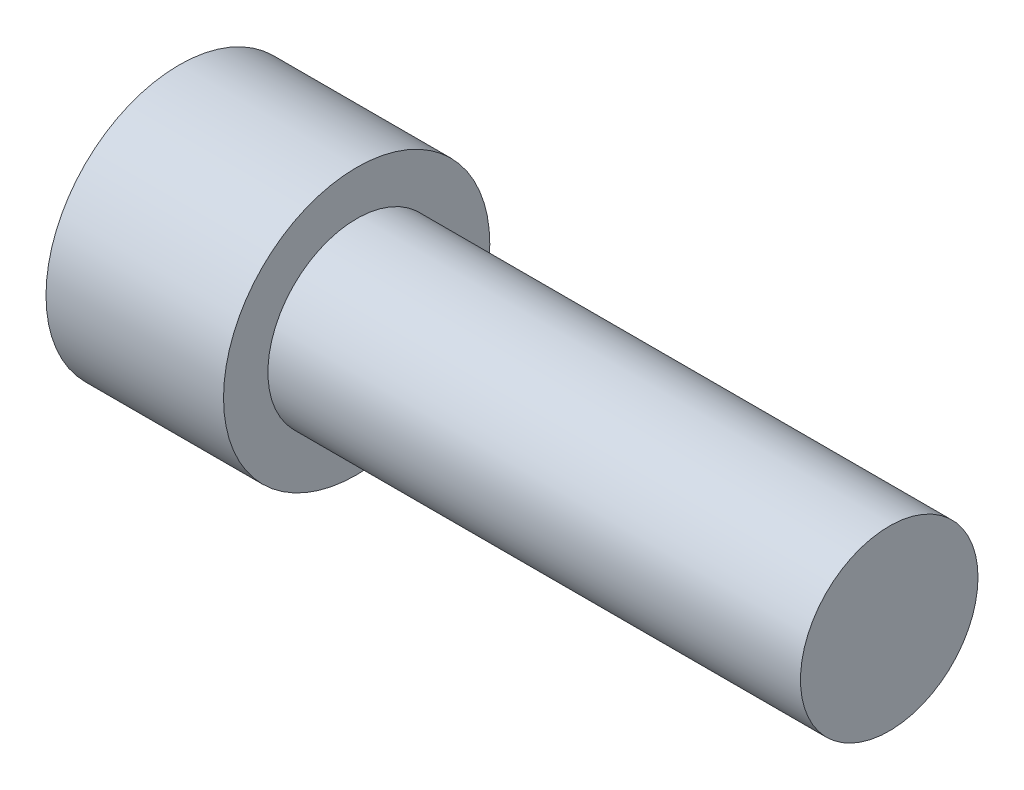
from build123d import *

# Parameters (mm, degrees)
SKETCH1_R             = 3.175
THREADED_SCREW_DEPTH  = 19.05
SKETCH2_R             = 4.7625
ROUND_HEAD_DEPTH      = 6.35
HEX_SOCKET_SIZE_DEPTH = 4


with BuildPart() as part:
    # Sketch1 → Threaded_Screw (new body)
    with BuildSketch(Plane(origin=(0, 0, 0), x_dir=(0, 0, -1), z_dir=(1, 0, 0))):
        Circle(SKETCH1_R)
    extrude(amount=THREADED_SCREW_DEPTH)

    # Sketch2 → Round_Head (add)
    with BuildSketch(Plane.ZY):
        Circle(SKETCH2_R)
    extrude(amount=ROUND_HEAD_DEPTH)

    # Sketch3 → Hex_Socket_Size (cut)
    with BuildSketch(Plane.ZY.offset(6.35)):
        Polygon((2.38125, -1.374815329), (2.38125, 1.374815329), (0, 2.749630657), (-2.38125, 1.374815329), (-2.38125, -1.374815329), (0, -2.749630657), align=None)
    extrude(amount=-HEX_SOCKET_SIZE_DEPTH, mode=Mode.SUBTRACT)


solid = part.part
